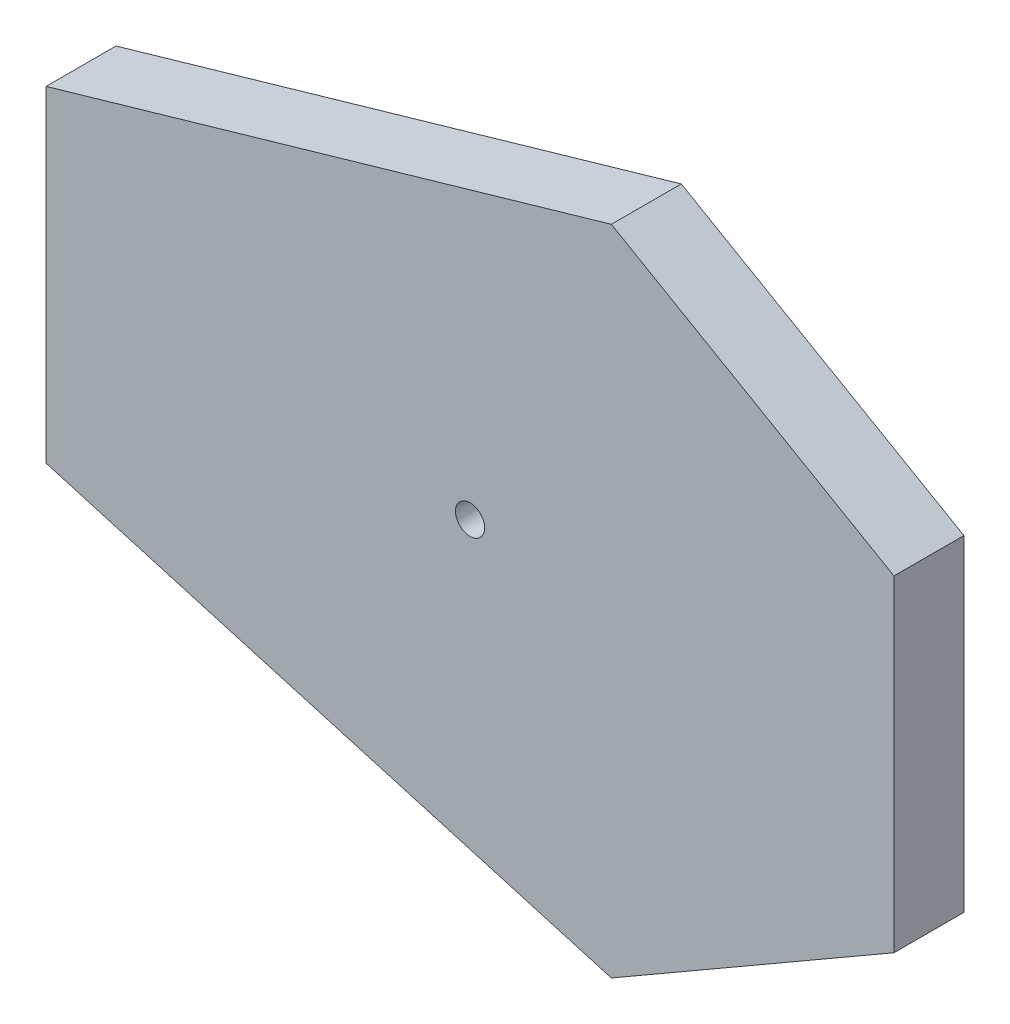
from build123d import *

# Parameters (mm, degrees)
SKETCH1_R           = 1.25
BOSS_EXTRUDE1_DEPTH = 6
SKETCH2_R           = 2.1
CUT_EXTRUDE1_DEPTH  = 3


with BuildPart() as part:
    # Sketch1 → Boss-Extrude1 (new body)
    with BuildSketch(Plane.XY):
        Polygon((-41.523066959, 14), (-41.523066959, -14), (6.974355653, -28), (31.223066959, -14), (31.223066959, 14), (6.974355653, 28), align=None)
        with Locations((-5.15, 0)):
            Circle(SKETCH1_R, mode=Mode.SUBTRACT)
    extrude(amount=BOSS_EXTRUDE1_DEPTH)

    # Sketch2 → Cut-Extrude1 (cut)
    with BuildSketch(Plane(origin=(0, 0, 0), x_dir=(-1, 0, 0), z_dir=(0, 0, -1))):
        with Locations((5.15, 0)):
            Circle(SKETCH2_R)
    extrude(amount=-CUT_EXTRUDE1_DEPTH, mode=Mode.SUBTRACT)


solid = part.part
